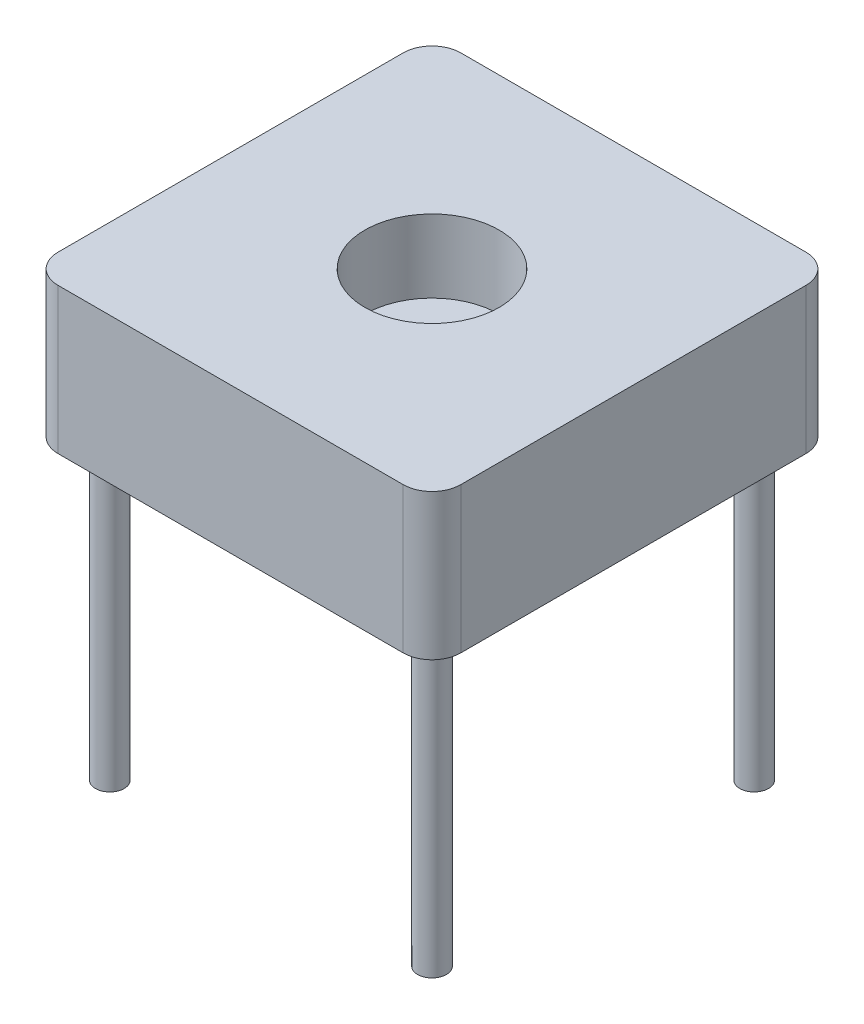
from build123d import *

# Parameters (mm, degrees)
BOSS_EXTRUDE1_DEPTH = 3.8
SKETCH2_2_R         = 1.75
CUT_EXTRUDE1_DEPTH  = 1.9
SKETCH3_R           = 0.375
BOSS_EXTRUDE3_DEPTH = 7.75


with BuildPart() as part:
    # Sketch1 → Boss-Extrude1 (new body)
    with BuildSketch(Plane(origin=(0, 0, 0), x_dir=(1, 0, 0), z_dir=(0, 1, 0))):
        with BuildLine():
            Line((0.75, 0), (9.75, 0))
            ThreePointArc((9.75, 0), (10.280330086, 0.219669914), (10.5, 0.75))
            Line((10.5, 0.75), (10.5, 9.75))
            ThreePointArc((10.5, 9.75), (10.280330086, 10.280330086), (9.75, 10.5))
            Line((9.75, 10.5), (0.75, 10.5))
            ThreePointArc((0.75, 10.5), (0.219669914, 10.280330086), (0, 9.75))
            Line((0, 9.75), (0, 0.75))
            ThreePointArc((0, 0.75), (0.219669914, 0.219669914), (0.75, 0))
        make_face()
    extrude(amount=BOSS_EXTRUDE1_DEPTH)

    # Sketch2<2> → Cut-Extrude1 (cut)
    with BuildSketch(Plane(origin=(0, 3.8, 0), x_dir=(1, 0, 0), z_dir=(0, 1, 0))):
        with Locations((5.25, 5.25)):
            Circle(SKETCH2_2_R)
    extrude(amount=-CUT_EXTRUDE1_DEPTH, mode=Mode.SUBTRACT)

    # Sketch3 → Boss-Extrude3 (add)
    with BuildSketch(Plane.XZ):
        with Locations((9.45, -1.05)):
            Circle(SKETCH3_R)
        with Locations((9.45, -9.45)):
            Circle(SKETCH3_R)
        with Locations((1.05, -9.45)):
            Circle(SKETCH3_R)
        with Locations((1.05, -1.05)):
            Circle(SKETCH3_R)
    extrude(amount=BOSS_EXTRUDE3_DEPTH)


solid = part.part
